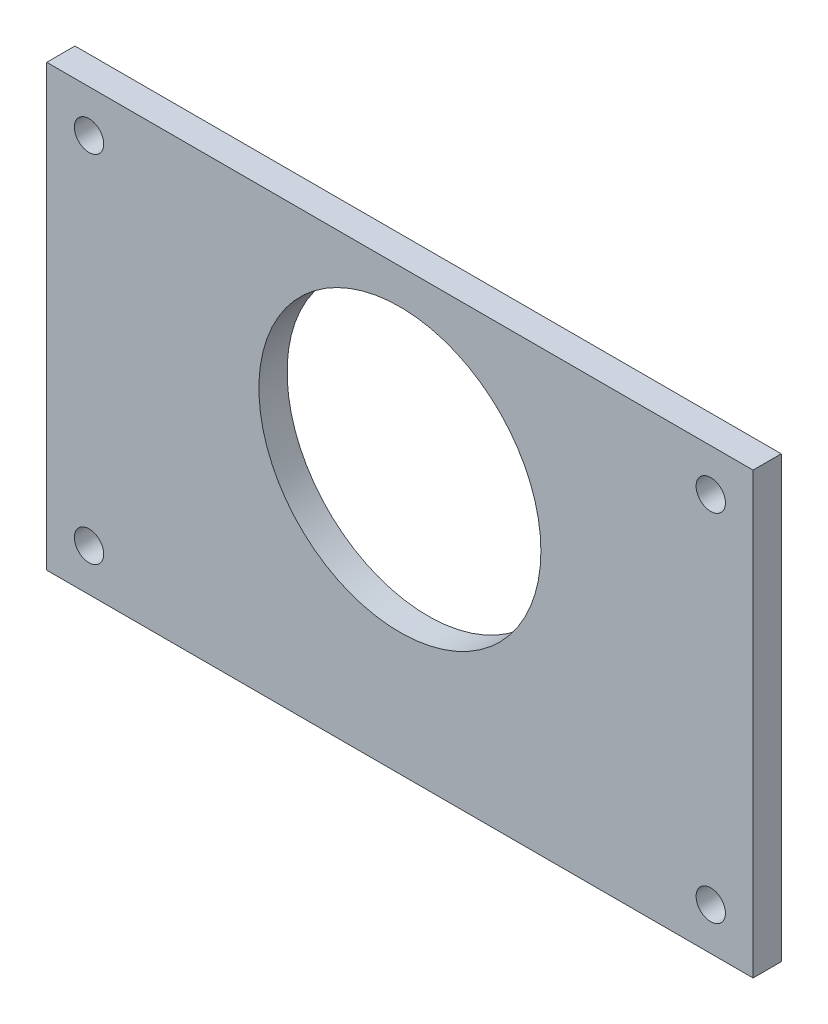
from build123d import *

# Parameters (mm, degrees)
SKETCH2_W           = 63.62
SKETCH2_H           = 39.62
SKETCH2_R           = 1.3208
SKETCH2_R_2         = 12.7
BOSS_EXTRUDE1_DEPTH = 2.54


with BuildPart() as part:
    # Sketch2 → Boss-Extrude1 (new body)
    with BuildSketch(Plane.XY):
        with Locations((0, -3.9477)):
            Rectangle(SKETCH2_W, SKETCH2_H)
        with Locations((-28, -19.9477)):
            Circle(SKETCH2_R, mode=Mode.SUBTRACT)
        with Locations((28, -19.9477)):
            Circle(SKETCH2_R, mode=Mode.SUBTRACT)
        with Locations((28, 12.0523)):
            Circle(SKETCH2_R, mode=Mode.SUBTRACT)
        with Locations((-28, 12.0523)):
            Circle(SKETCH2_R, mode=Mode.SUBTRACT)
        Circle(SKETCH2_R_2, mode=Mode.SUBTRACT)
    extrude(amount=BOSS_EXTRUDE1_DEPTH)


solid = part.part
